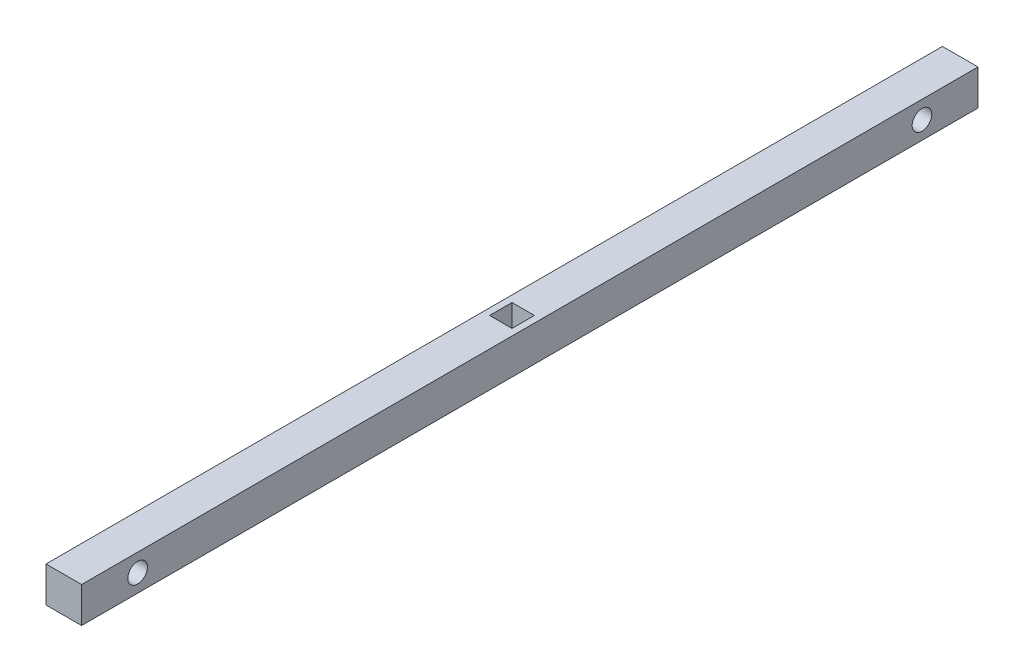
from build123d import *

# Parameters (mm, degrees)
BOSS_EXTRUDE1_DEPTH      = 609.6
BOSS_EXTRUDE1_DEPTH_BACK = 609.6
SKETCH3_W                = 6.35
SKETCH3_H                = 6.35
SKETCH4_W                = 7.35
SKETCH4_H                = 7.35
CUT_EXTRUDE1_DEPTH       = 1060.209517164
SKETCH5_R                = 1.75
CUT_EXTRUDE2_DEPTH       = 610.641339744
SKETCH6_W                = 4
SKETCH6_H                = 4
CUT_EXTRUDE3_DEPTH       = 610.641339744


with BuildPart() as part:
    # Sketch3 → Boss-Extrude1 (new, two sides: drawn at the far end of the back side and taken through both)
    with BuildSketch(Plane.XY.offset(-BOSS_EXTRUDE1_DEPTH_BACK)):
        Rectangle(SKETCH3_W, SKETCH3_H)
    extrude(amount=BOSS_EXTRUDE1_DEPTH + BOSS_EXTRUDE1_DEPTH_BACK)

    # Sketch4 → Cut-Extrude1 (cut, through all)
    with BuildSketch(Plane(origin=(0, 0, -449.6), x_dir=(-1, 0, 0), z_dir=(0, 0, -1))):
        Rectangle(SKETCH4_W, SKETCH4_H)
    extrude(amount=-CUT_EXTRUDE1_DEPTH, mode=Mode.SUBTRACT)

    # Sketch5 → Cut-Extrude2 (cut, through all)
    with BuildSketch(Plane(origin=(3.175, 0, 0), x_dir=(0, 1, 0), z_dir=(-1, 0, 0))):
        with Locations(Location((0, 599.6, 0), (0, 0, 270))):
            Circle(SKETCH5_R)
        with Locations(Location((0, 459.6, 0), (0, 0, 270))):
            Circle(SKETCH5_R)
    extrude(amount=CUT_EXTRUDE2_DEPTH, mode=Mode.SUBTRACT)

    # Sketch6 → Cut-Extrude3 (cut, through all)
    with BuildSketch(Plane(origin=(0, 3.175, 0), x_dir=(1, 0, 0), z_dir=(0, 1, 0))):
        with Locations((0, 529.6)):
            Rectangle(SKETCH6_W, SKETCH6_H)
    extrude(amount=-CUT_EXTRUDE3_DEPTH, mode=Mode.SUBTRACT)


solid = part.part
